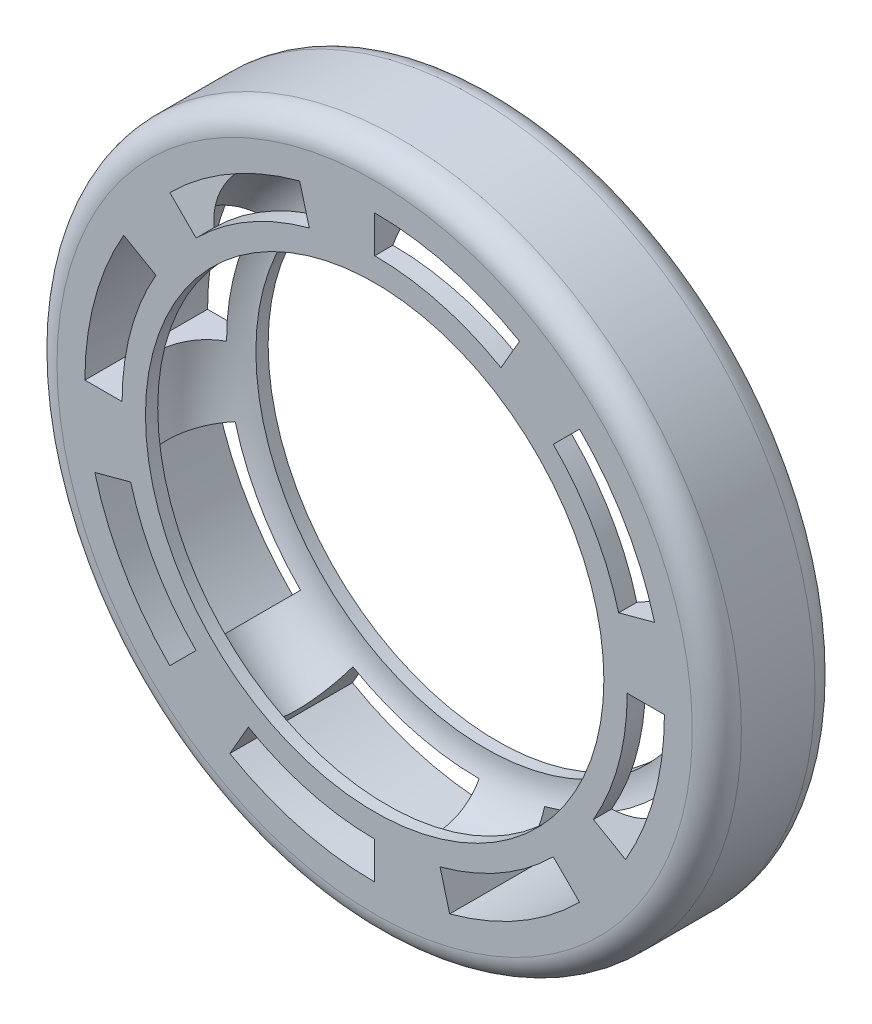
from build123d import *

# Parameters (mm, degrees)
FILLET1_R          = 2
CUT_EXTRUDE3_DEPTH = 14


with BuildPart() as part:
    # Sketch1 → Revolve1 (revolve)
    with BuildSketch(Plane(origin=(0, 0, 0), x_dir=(1, 0, 0), z_dir=(0, 1, 0)), mode=Mode.PRIVATE) as revolve1_sk:
        with BuildLine():
            Line((18.685, -4), (18.685, -5))
            Line((18.685, -5), (27.895, -5))
            Line((27.895, -5), (27.895, 5))
            Line((27.895, 5), (18.685, 5))
            Line((18.685, 5), (18.685, 4))
            ThreePointArc((18.685, 4), (22.685, 0), (18.685, -4))
        make_face()
    revolve(revolve1_sk.sketch.rotate(Axis((0, 0, -5.5), (0, 0, 1)), 180), axis=Axis((0, 0, -5.5), (0, 0, 1)))

    # Fillet1
    fillet1_edges = [part.edges().sort_by_distance(p)[0] for p in [
        (27.895, 0, 5),
        (27.895, 0, -5),
    ]]
    fillet(fillet1_edges, radius=FILLET1_R)

    # Sketch2 → Cut-Extrude3 (cut)
    with BuildSketch(Plane.XY.offset(5)):
        with BuildLine():
            Line((20.590043237, 0), (23.62183968, 0))
            ThreePointArc((23.62183968, 0), (22.816945011, -6.11378199), (20.457113247, -11.81091984))
            Line((20.457113247, -11.81091984), (17.831500509, -10.295021619))
            ThreePointArc((17.831500509, -10.295021619), (19.888454527, -5.329095329), (20.590043237, 0))
        make_face()
        with BuildLine():
            Line((14.559359198, -14.559359198), (16.703163022, -16.703163022))
            ThreePointArc((16.703163022, -16.703163022), (11.81091984, -20.457113247), (6.11378199, -22.816945011))
            Line((6.11378199, -22.816945011), (5.329095329, -19.888454527))
            ThreePointArc((5.329095329, -19.888454527), (10.295021619, -17.831500509), (14.559359198, -14.559359198))
        make_face()
        with BuildLine():
            Line((0, -20.590043237), (0, -23.62183968))
            ThreePointArc((0, -23.62183968), (-6.11378199, -22.816945011), (-11.81091984, -20.457113247))
            Line((-11.81091984, -20.457113247), (-10.295021619, -17.831500509))
            ThreePointArc((-10.295021619, -17.831500509), (-5.329095329, -19.888454527), (0, -20.590043237))
        make_face()
        with BuildLine():
            Line((-14.559359198, -14.559359198), (-16.703163022, -16.703163022))
            ThreePointArc((-16.703163022, -16.703163022), (-20.457113247, -11.81091984), (-22.816945011, -6.11378199))
            Line((-22.816945011, -6.11378199), (-19.888454527, -5.329095329))
            ThreePointArc((-19.888454527, -5.329095329), (-17.831500509, -10.295021619), (-14.559359198, -14.559359198))
        make_face()
        with BuildLine():
            Line((-20.590043237, 0), (-23.62183968, 0))
            ThreePointArc((-23.62183968, 0), (-22.816945011, 6.11378199), (-20.457113247, 11.81091984))
            Line((-20.457113247, 11.81091984), (-17.831500509, 10.295021619))
            ThreePointArc((-17.831500509, 10.295021619), (-19.888454527, 5.329095329), (-20.590043237, 0))
        make_face()
        with BuildLine():
            Line((-14.559359198, 14.559359198), (-16.703163022, 16.703163022))
            ThreePointArc((-16.703163022, 16.703163022), (-11.81091984, 20.457113247), (-6.11378199, 22.816945011))
            Line((-6.11378199, 22.816945011), (-5.329095329, 19.888454527))
            ThreePointArc((-5.329095329, 19.888454527), (-10.295021619, 17.831500509), (-14.559359198, 14.559359198))
        make_face()
        with BuildLine():
            Line((0, 20.590043237), (0, 23.62183968))
            ThreePointArc((0, 23.62183968), (6.11378199, 22.816945011), (11.81091984, 20.457113247))
            Line((11.81091984, 20.457113247), (10.295021619, 17.831500509))
            ThreePointArc((10.295021619, 17.831500509), (5.329095329, 19.888454527), (0, 20.590043237))
        make_face()
        with BuildLine():
            Line((14.559359198, 14.559359198), (16.703163022, 16.703163022))
            ThreePointArc((16.703163022, 16.703163022), (20.457113247, 11.81091984), (22.816945011, 6.11378199))
            Line((22.816945011, 6.11378199), (19.888454527, 5.329095329))
            ThreePointArc((19.888454527, 5.329095329), (17.831500509, 10.295021619), (14.559359198, 14.559359198))
        make_face()
    extrude(amount=-CUT_EXTRUDE3_DEPTH, mode=Mode.SUBTRACT)


solid = part.part
